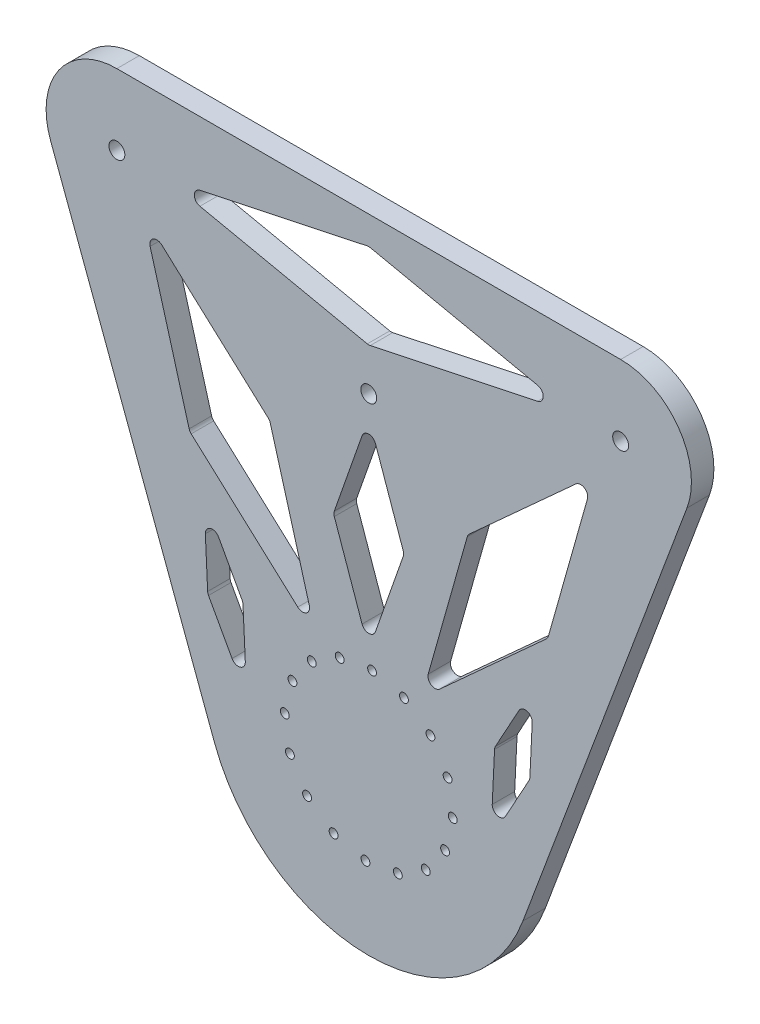
from build123d import *

# Parameters (mm, degrees)
BOSS_EXTRUDE1_DEPTH     = 3.175
FILLET1_R               = 20
SKETCH2_R               = 2.25
CUT_EXTRUDE1_DEPTH      = 164.037303514
CUT_EXTRUDE2_DEPTH      = 164.037303514
CUT_EXTRUDE2_DEPTH_BACK = 164.037303514
SKETCH3_R               = 1.25
CUT_EXTRUDE3_DEPTH      = 164.037303514
CUT_EXTRUDE3_DEPTH_BACK = 164.037303514
FILLET2_R               = 2


with BuildPart() as part:
    # Sketch1 → Boss-Extrude1 (new, symmetric)
    with BuildSketch(Plane.XY):
        with BuildLine():
            Line((43.566419732, -16.254755357), (100, 135))
            Line((100, 135), (-100, 135))
            Line((-100, 135), (-43.566419732, -16.254755357))
            ThreePointArc((-43.566419732, -16.254755357), (0, -46.5), (43.566419732, -16.254755357))
        make_face()
    extrude(amount=BOSS_EXTRUDE1_DEPTH, both=True)

    # Fillet1
    fillet1_edges = [part.edges().sort_by_distance(p)[0] for p in [
        (-100, 135, 0),
        (100, 135, 0),
    ]]
    fillet(fillet1_edges, radius=FILLET1_R)

    # Sketch2 → Cut-Extrude1 (cut, through all)
    with BuildSketch(Plane(origin=(0, 0, -3.175), x_dir=(-1, 0, 0), z_dir=(0, 0, -1))):
        with Locations((-71.191226755, 115)):
            Circle(SKETCH2_R)
        with Locations((71.191226755, 115)):
            Circle(SKETCH2_R)
        with Locations((0, 90.999999998)):
            Circle(SKETCH2_R)
    extrude(amount=-CUT_EXTRUDE1_DEPTH, mode=Mode.SUBTRACT)

    # Sketch3 → Cut-Extrude2 (cut, two sides: drawn at the far end of the back side and taken through both)
    with BuildSketch(Plane(origin=(0, 0, -3.175), x_dir=(-1, 0, 0), z_dir=(0, 0, -1)).offset(-CUT_EXTRUDE2_DEPTH_BACK)):
        with Locations((17.440159599, -16.121517706)):
            Circle(SKETCH3_R)
        with Locations((22.282044228, -8.220280106)):
            Circle(SKETCH3_R)
        with Locations((9.943168767, -21.568400378)):
            Circle(SKETCH3_R)
        with Locations((0.932420624, -23.731689611)):
            Circle(SKETCH3_R)
        with Locations((-8.220280106, -22.282044228)):
            Circle(SKETCH3_R)
        with Locations((-16.121517706, -17.440159599)):
            Circle(SKETCH3_R)
        with Locations((-21.568400378, -9.943168767)):
            Circle(SKETCH3_R)
        with Locations((-23.731689611, -0.932420624)):
            Circle(SKETCH3_R)
        with Locations((-22.282044228, 8.220280106)):
            Circle(SKETCH3_R)
        with Locations((-17.440159599, 16.121517706)):
            Circle(SKETCH3_R)
        with Locations((-9.943168767, 21.568400378)):
            Circle(SKETCH3_R)
        with Locations((-0.932420624, 23.731689611)):
            Circle(SKETCH3_R)
        with Locations((8.220280106, 22.282044228)):
            Circle(SKETCH3_R)
        with Locations((16.121517706, 17.440159599)):
            Circle(SKETCH3_R)
        with Locations((21.568400378, 9.943168767)):
            Circle(SKETCH3_R)
        with Locations((23.731689611, 0.932420624)):
            Circle(SKETCH3_R)
    extrude(amount=CUT_EXTRUDE2_DEPTH + CUT_EXTRUDE2_DEPTH_BACK, mode=Mode.SUBTRACT)

    # Sketch4 → Cut-Extrude3 (cut, two sides: drawn at the far end of the back side and taken through both)
    with BuildSketch(Plane.XY.offset(3.175).offset(-CUT_EXTRUDE3_DEPTH_BACK)):
        Polygon((-63.696742607, 102.893653244), (-50.607894628, 56.486565879), (-14.905780513, 24.078314663), (-27.994628493, 70.485402028), align=None)
        Polygon((63.696742607, 102.893653244), (50.607894628, 56.486565879), (14.905780513, 24.078314663), (27.994628493, 70.485402028), align=None)
        Polygon((0, 85.183808507), (-9.976320033, 56.751243307), (0, 28.318678107), (9.976320033, 56.751243307), align=None)
        Polygon((-56.952865739, 115), (0, 127.073716961), (56.952865739, 115), (0, 102.926283039), align=None)
        Polygon((-46.602642472, 42.285767842), (-45.512737624, 19.397766035), (-34.482528345, -0.686630956), (-35.572433193, 22.20137085), align=None)
        Polygon((46.602642472, 42.285767842), (35.572433193, 22.20137085), (34.482528345, -0.686630956), (45.512737624, 19.397766035), align=None)
    extrude(amount=CUT_EXTRUDE3_DEPTH + CUT_EXTRUDE3_DEPTH_BACK, mode=Mode.SUBTRACT)

    # Fillet2
    fillet2_edges = [part.edges().sort_by_distance(p)[0] for p in [
        (-46.602642472, 42.285767842, 0),
        (-35.572433193, 22.20137085, 0),
        (-34.482528345, -0.686630956, 0),
        (-45.512737624, 19.397766035, 0),
        (0, 85.183808507, 0),
        (9.976320033, 56.751243307, 0),
        (0, 28.318678107, 0),
        (-9.976320033, 56.751243307, 0),
        (0, 102.926283039, 0),
        (-56.952865739, 115, 0),
        (0, 127.073716961, 0),
        (56.952865739, 115, 0),
        (27.994628493, 70.485402028, 0),
        (63.696742607, 102.893653244, 0),
        (50.607894628, 56.486565879, 0),
        (14.905780513, 24.078314663, 0),
        (46.602642472, 42.285767842, 0),
        (45.512737624, 19.397766035, 0),
        (34.482528345, -0.686630956, 0),
        (35.572433193, 22.20137085, 0),
        (-63.696742607, 102.893653244, 0),
        (-27.994628493, 70.485402028, 0),
        (-14.905780513, 24.078314663, 0),
        (-50.607894628, 56.486565879, 0),
    ]]
    fillet(fillet2_edges, radius=FILLET2_R)


solid = part.part
